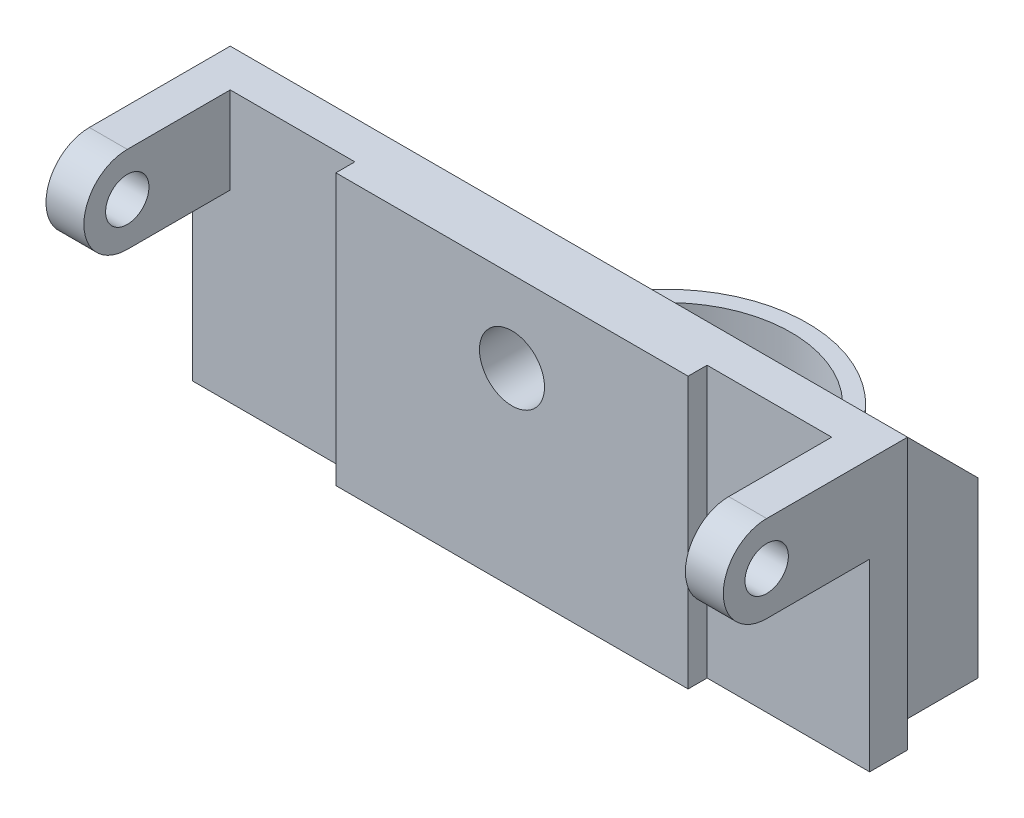
from build123d import *

# Parameters (mm, degrees)
SKETCH1_W           = 250
SKETCH1_H           = 100
BOSS_EXTRUDE1_DEPTH = 14
BOSS_EXTRUDE2_DEPTH = 100
SKETCH7_R           = 8
BOSS_EXTRUDE3_DEPTH = 14
SKETCH8_R           = 12
CUT_EXTRUDE1_DEPTH  = 25
BOSS_EXTRUDE4_DEPTH = 15
BOSS_EXTRUDE5_DEPTH = 12
SKETCH13_R          = 15
SKETCH13_R_2        = 7.5
BOSS_EXTRUDE6_DEPTH = 15
CUT_EXTRUDE2_START  = -15
SKETCH14_R          = 7.5
CUT_EXTRUDE2_DEPTH  = 15


with BuildPart() as part:
    # Sketch1 → Boss-Extrude1 (new body)
    with BuildSketch(Plane.XY):
        Rectangle(SKETCH1_W, SKETCH1_H)
    extrude(amount=BOSS_EXTRUDE1_DEPTH)

    # Sketch2 → Boss-Extrude2 (add)
    with BuildSketch(Plane(origin=(0, 50, 0), x_dir=(1, 0, 0), z_dir=(0, 1, 0))):
        Polygon((0, -14), (-65, -14), (-65, -21), (65, -21), (65, -14), align=None)
    extrude(amount=-BOSS_EXTRUDE2_DEPTH)

    # Sketch7 → Boss-Extrude3 (add)
    with BuildSketch(Plane.ZY.offset(125)):
        with BuildLine():
            Line((14, 50), (14, 18))
            Line((14, 18), (52, 18))
            ThreePointArc((52, 18), (68, 34), (52, 50))
            Line((52, 50), (14, 50))
        make_face()
        with Locations(Location((52, 34, 0), (0, 0, 270))):
            Circle(SKETCH7_R, mode=Mode.SUBTRACT)
    boss_extrude3 = extrude(amount=-BOSS_EXTRUDE3_DEPTH)

    # Mirror1: Boss-Extrude3 across plane
    add(boss_extrude3.mirror(Plane(origin=(0, 0, 0), x_dir=(0, 0, 1), z_dir=(1, 0, 0))))

    # Sketch8 → Cut-Extrude1 (cut)
    with BuildSketch(Plane(origin=(0, 0, 0), x_dir=(-1, 0, 0), z_dir=(0, 0, -1))):
        with Locations((0, 20)):
            Circle(SKETCH8_R)
    extrude(amount=-CUT_EXTRUDE1_DEPTH, mode=Mode.SUBTRACT)



with BuildPart() as body_2:
    # Sketch10 → Boss-Extrude4 (new body)
    with BuildSketch(Plane.XZ.offset(50)):
        with BuildLine():
            Line((115, 0), (115, -36))
            Line((115, -36), (23.513043478, -82.38034914))
            ThreePointArc((23.513043478, -82.38034914), (0, -88), (-23.513043478, -82.38034914))
            Line((-23.513043478, -82.38034914), (-115, -36))
            Line((-115, -36), (-115, 0))
            Line((-115, 0), (115, 0))
        make_face()
    extrude(amount=-BOSS_EXTRUDE4_DEPTH)


with BuildPart() as part_1:
    add(part.part)

    add(body_2.part)  # Boss-Extrude5 merges body 2
    # Sketch12 → Boss-Extrude5 (add)
    with BuildSketch(Plane(origin=(115, 0, 0), x_dir=(0, 0, -1), z_dir=(1, 0, 0))):
        Polygon((0, -35), (0, 50), (36, 14), (36, -35), align=None)
    boss_extrude5 = extrude(amount=-BOSS_EXTRUDE5_DEPTH)

    # Mirror2: Boss-Extrude5 across plane
    add(boss_extrude5.mirror(Plane(origin=(0, 0, 0), x_dir=(0, 0, 1), z_dir=(1, 0, 0))))

    # Sketch13 → Boss-Extrude6 (add)
    # profile 1 of 2: a face of its own
    with BuildSketch(Plane(origin=(0, -35, 0), x_dir=(1, 0, 0), z_dir=(0, 1, 0))):
        with Locations((0, 36)):
            Circle(SKETCH13_R)
        with Locations(Location((0, 36, 0), (0, 0, 180))):
            Circle(SKETCH13_R_2, mode=Mode.SUBTRACT)
    # profile 2 of 2: a face of its own
    with BuildSketch(Plane(origin=(0, -35, 0), x_dir=(1, 0, 0), z_dir=(0, 1, 0))):
        with BuildLine():
            ThreePointArc((24, 36), (0, 60), (-24, 36))
            ThreePointArc((-24, 36), (-38, 22), (-52, 36))
            ThreePointArc((-52, 36), (0, 88), (52, 36))
            ThreePointArc((52, 36), (38, 22), (24, 36))
        make_face()
        with BuildLine():
            ThreePointArc((30, 36), (0, 66), (-30, 36))
            ThreePointArc((-30, 36), (-38, 28), (-46, 36))
            ThreePointArc((-46, 36), (0, 82), (46, 36))
            ThreePointArc((46, 36), (38, 28), (30, 36))
        make_face(mode=Mode.SUBTRACT)
    extrude(amount=BOSS_EXTRUDE6_DEPTH)

    # Sketch14 → Cut-Extrude2 (cut)
    with BuildSketch(Plane(origin=(0, -35, 0), x_dir=(1, 0, 0), z_dir=(0, 1, 0)).offset(CUT_EXTRUDE2_START)):
        with Locations(Location((0, 36, 0), (0, 0, 180))):
            Circle(SKETCH14_R)
        with BuildLine():
            ThreePointArc((30, 36), (0, 66), (-30, 36))
            ThreePointArc((-30, 36), (-38, 28), (-46, 36))
            ThreePointArc((-46, 36), (0, 82), (46, 36))
            ThreePointArc((46, 36), (38, 28), (30, 36))
        make_face()
    extrude(amount=CUT_EXTRUDE2_DEPTH, mode=Mode.SUBTRACT)


solid = part_1.part
